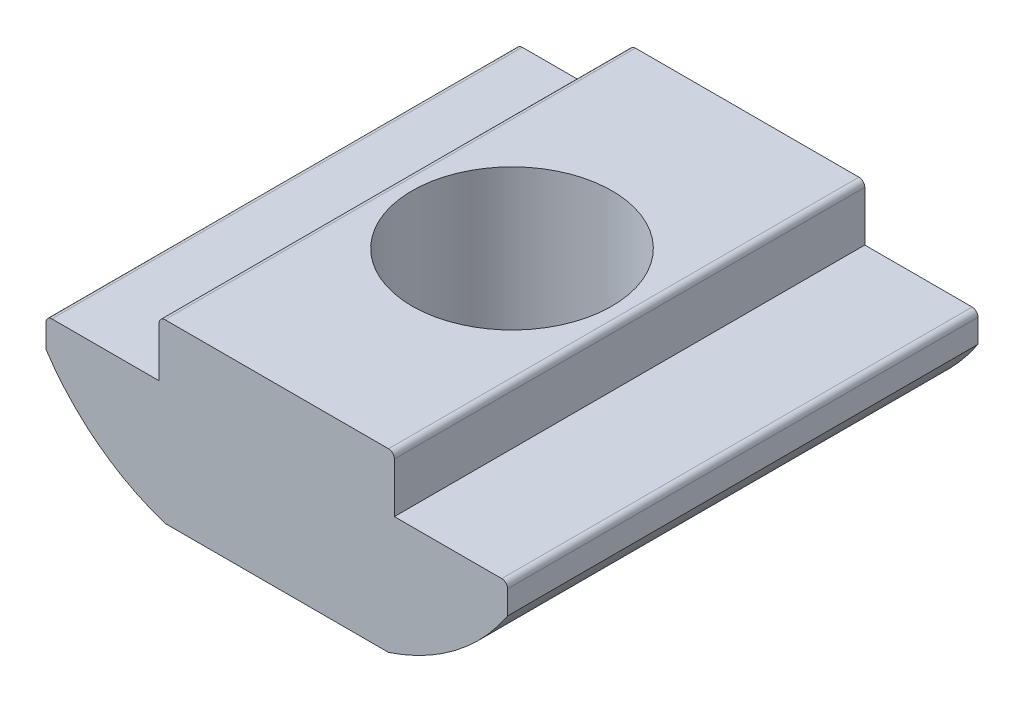
from build123d import *

# Parameters (mm, degrees)
EXTRUDE_1_DEPTH        = 8
HOLE_WIZARD_M8_1_D     = 6.8
HOLE_WIZARD_M8_1_DEPTH = 19.75
HOLE_WIZARD_M8_1_TIP   = 2.042926105


with BuildPart() as part:
    # 草图1 → 凸台-拉伸1 (new, symmetric)
    with BuildSketch(Plane.XY):
        with BuildLine():
            Line((3.8, 0), (-3.8, 0))
            ThreePointArc((-3.8, 0), (-6.087496121, 1.207061519), (-7.85, 3.1))
            Line((-7.85, 3.1), (-7.85, 3.9))
            ThreePointArc((-7.85, 3.9), (-7.791421356, 4.041421356), (-7.65, 4.1))
            Line((-7.65, 4.1), (-4, 4.1))
            Line((-4, 4.1), (-4, 5.8))
            ThreePointArc((-4, 5.8), (-3.941421356, 5.941421356), (-3.8, 6))
            Line((-3.8, 6), (3.8, 6))
            ThreePointArc((3.8, 6), (3.941421356, 5.941421356), (4, 5.8))
            Line((4, 5.8), (4, 4.1))
            Line((4, 4.1), (7.65, 4.1))
            ThreePointArc((7.65, 4.1), (7.791421356, 4.041421356), (7.85, 3.9))
            Line((7.85, 3.9), (7.85, 3.1))
            ThreePointArc((7.85, 3.1), (6.087496121, 1.207061519), (3.8, 0))
        make_face()
    extrude(amount=EXTRUDE_1_DEPTH, both=True)

    # M8 螺纹孔1
    with Locations(Plane.ZX.offset(6)):
        with Locations((0, 0)):
            Hole(HOLE_WIZARD_M8_1_D / 2, depth=HOLE_WIZARD_M8_1_DEPTH)
            with Locations((0, 0, -(HOLE_WIZARD_M8_1_DEPTH + HOLE_WIZARD_M8_1_TIP / 2))):  # 118° drill point
                Cone(0, HOLE_WIZARD_M8_1_D / 2, HOLE_WIZARD_M8_1_TIP, mode=Mode.SUBTRACT)


solid = part.part
